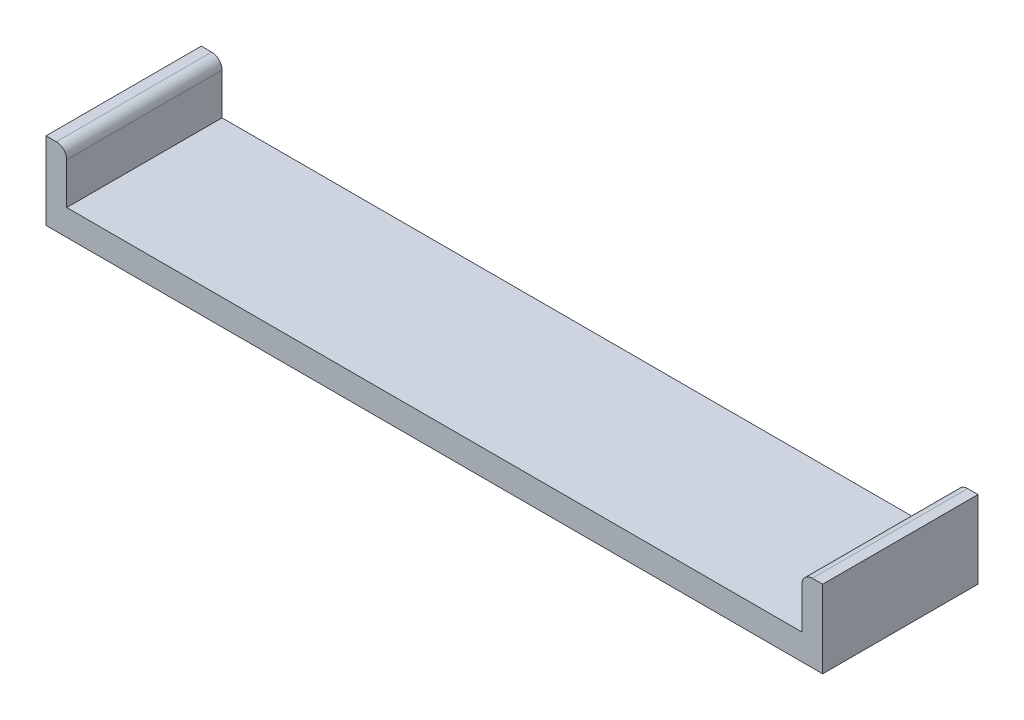
from build123d import *

# Parameters (mm, degrees)
SKETCH1_W           = 150
SKETCH1_H           = 30
BOSS_EXTRUDE1_DEPTH = 5
SKETCH3_W           = 4
SKETCH3_H           = 30
BOSS_EXTRUDE2_DEPTH = 10
SKETCH4_W           = 4
SKETCH4_H           = 30
BOSS_EXTRUDE3_DEPTH = 10
FILLET1_R           = 2


with BuildPart() as part:
    # Sketch1 → Boss-Extrude1 (new body)
    with BuildSketch(Plane(origin=(0, 0, 0), x_dir=(1, 0, 0), z_dir=(0, 1, 0))):
        with Locations((75, 15)):
            Rectangle(SKETCH1_W, SKETCH1_H)
    extrude(amount=BOSS_EXTRUDE1_DEPTH)

    # Sketch3 → Boss-Extrude2 (add)
    with BuildSketch(Plane(origin=(0, 5, 0), x_dir=(1, 0, 0), z_dir=(0, 1, 0))):
        with Locations((148, 15)):
            Rectangle(SKETCH3_W, SKETCH3_H)
    extrude(amount=BOSS_EXTRUDE2_DEPTH)

    # Sketch4 → Boss-Extrude3 (add)
    with BuildSketch(Plane(origin=(0, 5, 0), x_dir=(1, 0, 0), z_dir=(0, 1, 0))):
        with Locations((2, 15)):
            Rectangle(SKETCH4_W, SKETCH4_H)
    extrude(amount=BOSS_EXTRUDE3_DEPTH)

    # Fillet1
    fillet1_edges = [part.edges().sort_by_distance(p)[0] for p in [
        (146, 15, -15),
        (4, 15, -15),
    ]]
    fillet(fillet1_edges, radius=FILLET1_R)


solid = part.part
